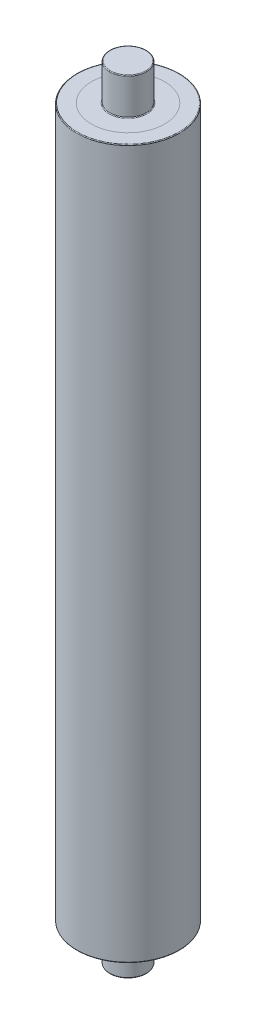
from build123d import *

# Parameters (mm, degrees)
FILLET1_R = 0.3


with BuildPart() as part:
    # Sketch1 → Revolve1 (revolve)
    with BuildSketch(Plane.XY):
        Polygon((0, 0), (0, 320), (7.5, 320), (7.5, 305), (21, 305), (21, 15), (7.5, 15), (7.5, 0), align=None)
    revolve(axis=Axis((0, 0, 0), (0, 1, 0)))

    # Fillet1
    fillet1_edges = [part.edges().sort_by_distance(p)[0] for p in [
        (-7.5, 0, 0),
        (-7.5, 15, 0),
        (-21, 15, 0),
        (-7.5, 320, 0),
        (-21, 305, 0),
        (-7.5, 305, 0),
    ]]
    fillet(fillet1_edges, radius=FILLET1_R)


solid = part.part
